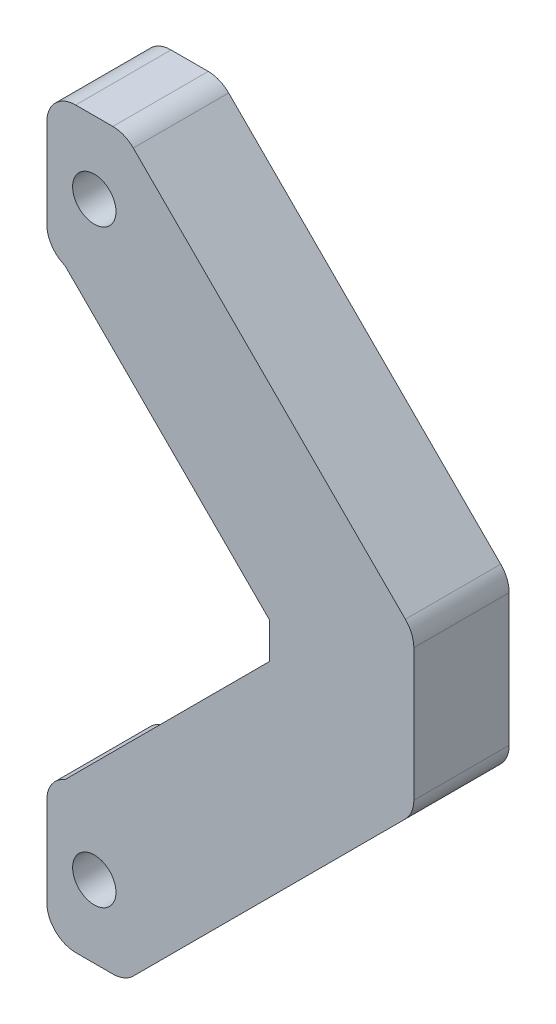
from build123d import *

# Parameters (mm, degrees)
MODEL_R             = 1.5
BOSS_EXTRUDE1_DEPTH = 6.6


with BuildPart() as part:
    # Model → Boss-Extrude1 (new body)
    with BuildSketch(Plane.XY):
        with BuildLine():
            Line((12.114213562, 5.985786438), (-6.714213562, 24.814213562))
            ThreePointArc((-6.714213562, 24.814213562), (-7.36306026, 25.247759065), (-8.128427125, 25.4))
            Line((-8.128427125, 25.4), (-10.7, 25.4))
            ThreePointArc((-10.7, 25.4), (-12.114213562, 24.814213562), (-12.7, 23.4))
            Line((-12.7, 23.4), (-12.7, 17.257211543))
            ThreePointArc((-12.7, 17.257211543), (-12.355939499, 16.135666013), (-11.442135624, 15.4))
            Line((-11.442135624, 15.4), (2.7, 1.257864376))
            Line((2.7, 1.257864376), (2.7, -1.257864376))
            Line((2.7, -1.257864376), (-11.442135624, -15.4))
            ThreePointArc((-11.442135624, -15.4), (-12.355939499, -16.135666013), (-12.7, -17.257211543))
            Line((-12.7, -17.257211543), (-12.7, -23.4))
            ThreePointArc((-12.7, -23.4), (-12.114213562, -24.814213562), (-10.7, -25.4))
            Line((-10.7, -25.4), (-8.128427125, -25.4))
            ThreePointArc((-8.128427125, -25.4), (-7.36306026, -25.247759065), (-6.714213562, -24.814213562))
            Line((-6.714213562, -24.814213562), (12.114213562, -5.985786438))
            ThreePointArc((12.114213562, -5.985786438), (12.547759065, -5.33693974), (12.7, -4.571572875))
            Line((12.7, -4.571572875), (12.7, 4.571572875))
            ThreePointArc((12.7, 4.571572875), (12.547759065, 5.33693974), (12.114213562, 5.985786438))
        make_face()
        with Locations((-9.414213562, 20.4)):
            Circle(MODEL_R, mode=Mode.SUBTRACT)
        with Locations((-9.414213562, -20.4)):
            Circle(MODEL_R, mode=Mode.SUBTRACT)
    extrude(amount=BOSS_EXTRUDE1_DEPTH)


solid = part.part
